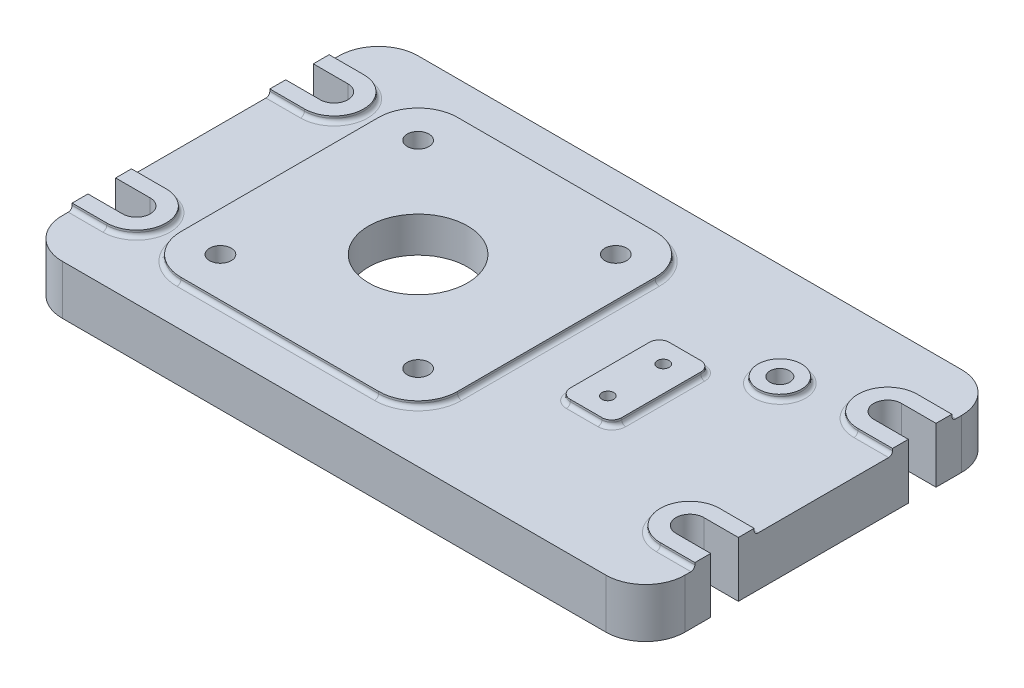
from build123d import *

# Parameters (mm, degrees)
SKETCH1_R           = 11
BOSS_EXTRUDE1_DEPTH = 25
SKETCH1_3_R         = 5.5
SKETCH1_3_R_2       = 25
SKETCH1_3_R_3       = 3
SKETCH1_3_R_4       = 11
SKETCH1_3_R_5       = 5
BOSS_EXTRUDE2_DEPTH = 28
SKETCH2_R           = 8
SKETCH2_R_2         = 5
CUT_EXTRUDE1_DEPTH  = 10
SKETCH2_2_R         = 8
SKETCH2_2_R_2       = 5
SKETCH2_2_R_3       = 3
CUT_EXTRUDE2_DEPTH  = 20
FILLET1_R           = 2


with BuildPart() as part:
    # Sketch1 → Boss-Extrude1 (new body)
    with BuildSketch(Plane(origin=(0, 0, 0), x_dir=(1, 0, 0), z_dir=(0, 1, 0))):
        with BuildLine():
            Line((-157.5, 70), (-157.5, 65))
            Line((-157.5, 65), (-140, 65))
            ThreePointArc((-140, 65), (-125, 50), (-140, 35))
            Line((-140, 35), (-157.5, 35))
            Line((-157.5, 35), (-157.5, -35))
            Line((-157.5, -35), (-140, -35))
            ThreePointArc((-140, -35), (-125, -50), (-140, -65))
            Line((-140, -65), (-157.5, -65))
            Line((-157.5, -65), (-157.5, -70))
            ThreePointArc((-157.5, -70), (-151.642135624, -84.142135624), (-137.5, -90))
            Line((-137.5, -90), (137.5, -90))
            ThreePointArc((137.5, -90), (151.642135624, -84.142135624), (157.5, -70))
            Line((157.5, -70), (157.5, -65))
            Line((157.5, -65), (140, -65))
            ThreePointArc((140, -65), (125, -50), (140, -35))
            Line((140, -35), (157.5, -35))
            Line((157.5, -35), (157.5, 35))
            Line((157.5, 35), (140, 35))
            ThreePointArc((140, 35), (125, 50), (140, 65))
            Line((140, 65), (157.5, 65))
            Line((157.5, 65), (157.5, 70))
            ThreePointArc((157.5, 70), (151.642135624, 84.142135624), (137.5, 90))
            Line((137.5, 90), (-137.5, 90))
            ThreePointArc((-137.5, 90), (-151.642135624, 84.142135624), (-157.5, 70))
        make_face()
        with BuildLine():
            ThreePointArc((-117.5, 50), (-111.642135624, 64.142135624), (-97.5, 70))
            Line((-97.5, 70), (2.5, 70))
            ThreePointArc((2.5, 70), (16.642135624, 64.142135624), (22.5, 50))
            Line((22.5, 50), (22.5, -50))
            ThreePointArc((22.5, -50), (16.642135624, -64.142135624), (2.5, -70))
            Line((2.5, -70), (-97.5, -70))
            ThreePointArc((-97.5, -70), (-111.642135624, -64.142135624), (-117.5, -50))
            Line((-117.5, -50), (-117.5, 50))
        make_face(mode=Mode.SUBTRACT)
        with BuildLine():
            ThreePointArc((49.5, 20), (50.964466094, 23.535533906), (54.5, 25))
            Line((54.5, 25), (70.5, 25))
            ThreePointArc((70.5, 25), (74.035533906, 23.535533906), (75.5, 20))
            Line((75.5, 20), (75.5, -20))
            ThreePointArc((75.5, -20), (74.035533906, -23.535533906), (70.5, -25))
            Line((70.5, -25), (54.5, -25))
            ThreePointArc((54.5, -25), (50.964466094, -23.535533906), (49.5, -20))
            Line((49.5, -20), (49.5, 20))
        make_face(mode=Mode.SUBTRACT)
        with Locations((97.5, 38)):
            Circle(SKETCH1_R, mode=Mode.SUBTRACT)
    extrude(amount=BOSS_EXTRUDE1_DEPTH)

    # Sketch1<3> → Boss-Extrude2 (add)
    # profile 1 of 7: a face of its own
    with BuildSketch(Plane(origin=(0, 0, 0), x_dir=(1, 0, 0), z_dir=(0, 1, 0))):
        with BuildLine():
            Line((-140, 65), (-157.5, 65))
            Line((-157.5, 65), (-157.5, 57))
            Line((-157.5, 57), (-140, 57))
            ThreePointArc((-140, 57), (-133, 50), (-140, 43))
            Line((-140, 43), (-157.5, 43))
            Line((-157.5, 43), (-157.5, 35))
            Line((-157.5, 35), (-140, 35))
            ThreePointArc((-140, 35), (-125, 50), (-140, 65))
        make_face()
    # profile 2 of 7: a face of its own
    with BuildSketch(Plane(origin=(0, 0, 0), x_dir=(1, 0, 0), z_dir=(0, 1, 0))):
        with BuildLine():
            Line((-140, -35), (-157.5, -35))
            Line((-157.5, -35), (-157.5, -43))
            Line((-157.5, -43), (-140, -43))
            ThreePointArc((-140, -43), (-133, -50), (-140, -57))
            Line((-140, -57), (-157.5, -57))
            Line((-157.5, -57), (-157.5, -65))
            Line((-157.5, -65), (-140, -65))
            ThreePointArc((-140, -65), (-125, -50), (-140, -35))
        make_face()
    # profile 3 of 7: a face of its own
    with BuildSketch(Plane(origin=(0, 0, 0), x_dir=(1, 0, 0), z_dir=(0, 1, 0))):
        with BuildLine():
            Line((157.5, 57), (157.5, 65))
            Line((157.5, 65), (140, 65))
            ThreePointArc((140, 65), (125, 50), (140, 35))
            Line((140, 35), (157.5, 35))
            Line((157.5, 35), (157.5, 43))
            Line((157.5, 43), (140, 43))
            ThreePointArc((140, 43), (133, 50), (140, 57))
            Line((140, 57), (157.5, 57))
        make_face()
    # profile 4 of 7: a face of its own
    with BuildSketch(Plane(origin=(0, 0, 0), x_dir=(1, 0, 0), z_dir=(0, 1, 0))):
        with BuildLine():
            Line((157.5, -43), (157.5, -35))
            Line((157.5, -35), (140, -35))
            ThreePointArc((140, -35), (125, -50), (140, -65))
            Line((140, -65), (157.5, -65))
            Line((157.5, -65), (157.5, -57))
            Line((157.5, -57), (140, -57))
            ThreePointArc((140, -57), (133, -50), (140, -43))
            Line((140, -43), (157.5, -43))
        make_face()
    # profile 5 of 7: a face of its own
    with BuildSketch(Plane(origin=(0, 0, 0), x_dir=(1, 0, 0), z_dir=(0, 1, 0))):
        with BuildLine():
            Line((2.5, 70), (-97.5, 70))
            ThreePointArc((-97.5, 70), (-111.642135624, 64.142135624), (-117.5, 50))
            Line((-117.5, 50), (-117.5, -50))
            ThreePointArc((-117.5, -50), (-111.642135624, -64.142135624), (-97.5, -70))
            Line((-97.5, -70), (2.5, -70))
            ThreePointArc((2.5, -70), (16.642135624, -64.142135624), (22.5, -50))
            Line((22.5, -50), (22.5, 50))
            ThreePointArc((22.5, 50), (16.642135624, 64.142135624), (2.5, 70))
        make_face()
        with Locations((-97.5, -50)):
            Circle(SKETCH1_3_R, mode=Mode.SUBTRACT)
        with Locations((2.5, -50)):
            Circle(SKETCH1_3_R, mode=Mode.SUBTRACT)
        with Locations((-47.5, 0)):
            Circle(SKETCH1_3_R_2, mode=Mode.SUBTRACT)
        with Locations((-97.5, 50)):
            Circle(SKETCH1_3_R, mode=Mode.SUBTRACT)
        with Locations((2.5, 50)):
            Circle(SKETCH1_3_R, mode=Mode.SUBTRACT)
    # profile 6 of 7: a face of its own
    with BuildSketch(Plane(origin=(0, 0, 0), x_dir=(1, 0, 0), z_dir=(0, 1, 0))):
        with BuildLine():
            Line((70.5, 25), (54.5, 25))
            ThreePointArc((54.5, 25), (50.964466094, 23.535533906), (49.5, 20))
            Line((49.5, 20), (49.5, -20))
            ThreePointArc((49.5, -20), (50.964466094, -23.535533906), (54.5, -25))
            Line((54.5, -25), (70.5, -25))
            ThreePointArc((70.5, -25), (74.035533906, -23.535533906), (75.5, -20))
            Line((75.5, -20), (75.5, 20))
            ThreePointArc((75.5, 20), (74.035533906, 23.535533906), (70.5, 25))
        make_face()
        with Locations((62.5, -14)):
            Circle(SKETCH1_3_R_3, mode=Mode.SUBTRACT)
        with Locations((62.5, 14)):
            Circle(SKETCH1_3_R_3, mode=Mode.SUBTRACT)
    # profile 7 of 7: a face of its own
    with BuildSketch(Plane(origin=(0, 0, 0), x_dir=(1, 0, 0), z_dir=(0, 1, 0))):
        with Locations((97.5, 38)):
            Circle(SKETCH1_3_R_4)
        with Locations((97.5, 38)):
            Circle(SKETCH1_3_R_5, mode=Mode.SUBTRACT)
    extrude(amount=BOSS_EXTRUDE2_DEPTH)

    # Sketch2 → Cut-Extrude1 (cut)
    with BuildSketch(Plane.XZ):
        with BuildLine():
            Line((-112.5, 70), (112.5, 70))
            ThreePointArc((112.5, 70), (116.035533906, 68.535533906), (117.5, 65))
            Line((117.5, 65), (117.5, 30))
            ThreePointArc((117.5, 30), (118.964466094, 26.464466094), (122.5, 25))
            Line((122.5, 25), (132.5, 25))
            ThreePointArc((132.5, 25), (136.035533906, 23.535533906), (137.5, 20))
            Line((137.5, 20), (137.5, -20))
            ThreePointArc((137.5, -20), (136.035533906, -23.535533906), (132.5, -25))
            Line((132.5, -25), (122.5, -25))
            ThreePointArc((122.5, -25), (118.964466094, -26.464466094), (117.5, -30))
            Line((117.5, -30), (117.5, -65))
            ThreePointArc((117.5, -65), (116.035533906, -68.535533906), (112.5, -70))
            Line((112.5, -70), (-112.5, -70))
            ThreePointArc((-112.5, -70), (-116.035533906, -68.535533906), (-117.5, -65))
            Line((-117.5, -65), (-117.5, -30))
            ThreePointArc((-117.5, -30), (-118.964466094, -26.464466094), (-122.5, -25))
            Line((-122.5, -25), (-132.5, -25))
            ThreePointArc((-132.5, -25), (-136.035533906, -23.535533906), (-137.5, -20))
            Line((-137.5, -20), (-137.5, 20))
            ThreePointArc((-137.5, 20), (-136.035533906, 23.535533906), (-132.5, 25))
            Line((-132.5, 25), (-122.5, 25))
            ThreePointArc((-122.5, 25), (-118.964466094, 26.464466094), (-117.5, 30))
            Line((-117.5, 30), (-117.5, 65))
            ThreePointArc((-117.5, 65), (-116.035533906, 68.535533906), (-112.5, 70))
        make_face()
        with Locations((-97.5, 50)):
            Circle(SKETCH2_R, mode=Mode.SUBTRACT)
        with Locations((2.5, 50)):
            Circle(SKETCH2_R, mode=Mode.SUBTRACT)
        with Locations((2.5, -50)):
            Circle(SKETCH2_R, mode=Mode.SUBTRACT)
        with Locations((-97.5, -50)):
            Circle(SKETCH2_R, mode=Mode.SUBTRACT)
        with Locations((62.5, -14)):
            Circle(SKETCH2_R_2, mode=Mode.SUBTRACT)
        with Locations((62.5, 14)):
            Circle(SKETCH2_R_2, mode=Mode.SUBTRACT)
    extrude(amount=-CUT_EXTRUDE1_DEPTH, mode=Mode.SUBTRACT)

    # Sketch2<2> → Cut-Extrude2 (cut)
    # profile 1 of 6: a face of its own
    with BuildSketch(Plane.XZ):
        with Locations((-97.5, 50)):
            Circle(SKETCH2_2_R)
    # profile 2 of 6: a face of its own
    with BuildSketch(Plane.XZ):
        with Locations((2.5, 50)):
            Circle(SKETCH2_2_R)
    # profile 3 of 6: a face of its own
    with BuildSketch(Plane.XZ):
        with Locations((2.5, -50)):
            Circle(SKETCH2_2_R)
    # profile 4 of 6: a face of its own
    with BuildSketch(Plane.XZ):
        with Locations((-97.5, -50)):
            Circle(SKETCH2_2_R)
    # profile 5 of 6: a face of its own
    with BuildSketch(Plane.XZ):
        with Locations((62.5, -14)):
            Circle(SKETCH2_2_R_2)
        with Locations((62.5, -14)):
            Circle(SKETCH2_2_R_3, mode=Mode.SUBTRACT)
    # profile 6 of 6: a face of its own
    with BuildSketch(Plane.XZ):
        with Locations((62.5, 14)):
            Circle(SKETCH2_2_R_2)
        with Locations((62.5, 14)):
            Circle(SKETCH2_2_R_3, mode=Mode.SUBTRACT)
    extrude(amount=-CUT_EXTRUDE2_DEPTH, mode=Mode.SUBTRACT)

    # Fillet1
    fillet1_edges = [part.edges().sort_by_distance(p)[0] for p in [
        (148.75, 25, -65),
        (125, 25, -50),
        (148.75, 25, 35),
        (125, 25, 50),
        (62.5, 25, 25),
        (50.964466094, 25, 23.535533906),
        (49.5, 25, 0),
        (50.964466094, 25, -23.535533906),
        (62.5, 25, -25),
        (74.035533906, 25, -23.535533906),
        (75.5, 25, 0),
        (-111.642135624, 25, 64.142135624),
        (-117.5, 25, 0),
        (-111.642135624, 25, -64.142135624),
        (-47.5, 25, -70),
        (16.642135624, 25, -64.142135624),
        (22.5, 25, 0),
        (16.642135624, 25, 64.142135624),
        (-148.75, 25, -65),
        (-148.75, 25, -35),
        (-148.75, 25, 65),
        (-148.75, 25, 35),
        (148.75, 25, -35),
        (148.75, 25, 65),
        (86.5, 25, -38),
        (74.035533906, 25, 23.535533906),
        (-47.5, 25, 70),
        (-125, 25, -50),
        (-125, 25, 50),
    ]]
    fillet(fillet1_edges, radius=FILLET1_R)


solid = part.part
